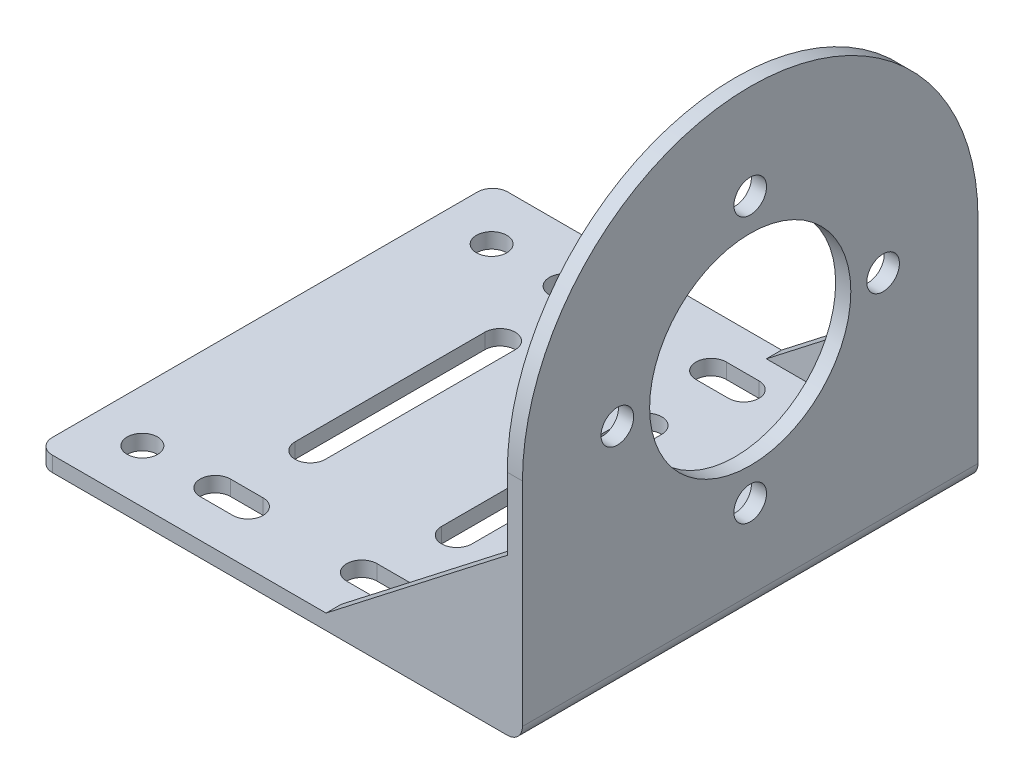
from build123d import *

# Parameters (mm, degrees)
SKETCH1_R           = 2.15
SKETCH1_R_2         = 13.25
BOSS_EXTRUDE1_DEPTH = 2
SKETCH2_W           = 63.93
SKETCH2_H           = 60
SKETCH2_R           = 2
BOSS_EXTRUDE2_DEPTH = 2
BOSS_EXTRUDE3_DEPTH = 2
BOSS_EXTRUDE4_DEPTH = 2
FILLET1_R           = 2


with BuildPart() as part:
    # Sketch1 → Boss-Extrude1 (new body)
    with BuildSketch(Plane(origin=(0, 0, 0), x_dir=(0, 0, -1), z_dir=(1, 0, 0))):
        with BuildLine():
            Line((0, 0), (60, 0))
            Line((60, 0), (60, 30))
            ThreePointArc((60, 30), (30, 60), (0, 30))
            Line((0, 30), (0, 0))
        make_face()
        with Locations((30, 47.5)):
            Circle(SKETCH1_R, mode=Mode.SUBTRACT)
        with Locations((30, 30)):
            Circle(SKETCH1_R_2, mode=Mode.SUBTRACT)
        with Locations((47.5, 30)):
            Circle(SKETCH1_R, mode=Mode.SUBTRACT)
        with Locations((30, 12.5)):
            Circle(SKETCH1_R, mode=Mode.SUBTRACT)
        with Locations((12.5, 30)):
            Circle(SKETCH1_R, mode=Mode.SUBTRACT)
    extrude(amount=BOSS_EXTRUDE1_DEPTH)

    # Sketch2 → Boss-Extrude2 (add)
    with BuildSketch(Plane(origin=(0, 0, 0), x_dir=(1, 0, 0), z_dir=(0, 1, 0))):
        with Locations((-29.965, 30)):
            Rectangle(SKETCH2_W, SKETCH2_H)
        with Locations(Location((-12, 53, 0), (0, 0, 270))):
            Circle(SKETCH2_R, mode=Mode.SUBTRACT)
        with Locations(Location((-55.059526056, 53, 0), (0, 0, 270))):
            Circle(SKETCH2_R, mode=Mode.SUBTRACT)
        with Locations(Location((-55.059526056, 7, 0), (0, 0, 90))):
            Circle(SKETCH2_R, mode=Mode.SUBTRACT)
        with Locations(Location((-12, 7, 0), (0, 0, 90))):
            Circle(SKETCH2_R, mode=Mode.SUBTRACT)
        with BuildLine():
            Line((-21.85, 51), (-26.15, 51))
            ThreePointArc((-26.15, 51), (-28.15, 53), (-26.15, 55))
            Line((-26.15, 55), (-21.85, 55))
            ThreePointArc((-21.85, 55), (-19.85, 53), (-21.85, 51))
        make_face(mode=Mode.SUBTRACT)
        with BuildLine():
            Line((-41.15, 51), (-45.45, 51))
            ThreePointArc((-45.45, 51), (-47.45, 53), (-45.45, 55))
            Line((-45.45, 55), (-41.15, 55))
            ThreePointArc((-41.15, 55), (-39.15, 53), (-41.15, 51))
        make_face(mode=Mode.SUBTRACT)
        with BuildLine():
            Line((-41.15, 9), (-45.45, 9))
            ThreePointArc((-45.45, 9), (-47.45, 7), (-45.45, 5))
            Line((-45.45, 5), (-41.15, 5))
            ThreePointArc((-41.15, 5), (-39.15, 7), (-41.15, 9))
        make_face(mode=Mode.SUBTRACT)
        with BuildLine():
            Line((-21.85, 9), (-26.15, 9))
            ThreePointArc((-26.15, 9), (-28.15, 7), (-26.15, 5))
            Line((-26.15, 5), (-21.85, 5))
            ThreePointArc((-21.85, 5), (-19.85, 7), (-21.85, 9))
        make_face(mode=Mode.SUBTRACT)
        with BuildLine():
            Line((-22.15, 42.5), (-22.15, 17.5))
            ThreePointArc((-22.15, 17.5), (-24.15, 15.5), (-26.15, 17.5))
            Line((-26.15, 17.5), (-26.15, 42.5))
            ThreePointArc((-26.15, 42.5), (-24.15, 44.5), (-22.15, 42.5))
        make_face(mode=Mode.SUBTRACT)
        with BuildLine():
            Line((-41.45, 42.5), (-41.45, 17.5))
            ThreePointArc((-41.45, 17.5), (-43.45, 15.5), (-45.45, 17.5))
            Line((-45.45, 17.5), (-45.45, 42.5))
            ThreePointArc((-45.45, 42.5), (-43.45, 44.5), (-41.45, 42.5))
        make_face(mode=Mode.SUBTRACT)
    extrude(amount=BOSS_EXTRUDE2_DEPTH)

    # Sketch3 → Boss-Extrude3 (add)
    with BuildSketch(Plane(origin=(0, 0, -60), x_dir=(-1, 0, 0), z_dir=(0, 0, -1))):
        Polygon((0, 20.525104105), (23.871014094, 2), (0, 2), align=None)
    extrude(amount=-BOSS_EXTRUDE3_DEPTH)

    # Sketch4 → Boss-Extrude4 (add)
    with BuildSketch(Plane.XY):
        Polygon((0, 20.525104105), (-23.871014094, 2), (0, 2), align=None)
    extrude(amount=-BOSS_EXTRUDE4_DEPTH)

    # Fillet1
    fillet1_edges = [part.edges().sort_by_distance(p)[0] for p in [
        (-61.93, 1, 0),
        (-61.93, 1, -60),
        (2, 0, -30),
    ]]
    fillet(fillet1_edges, radius=FILLET1_R)


solid = part.part
